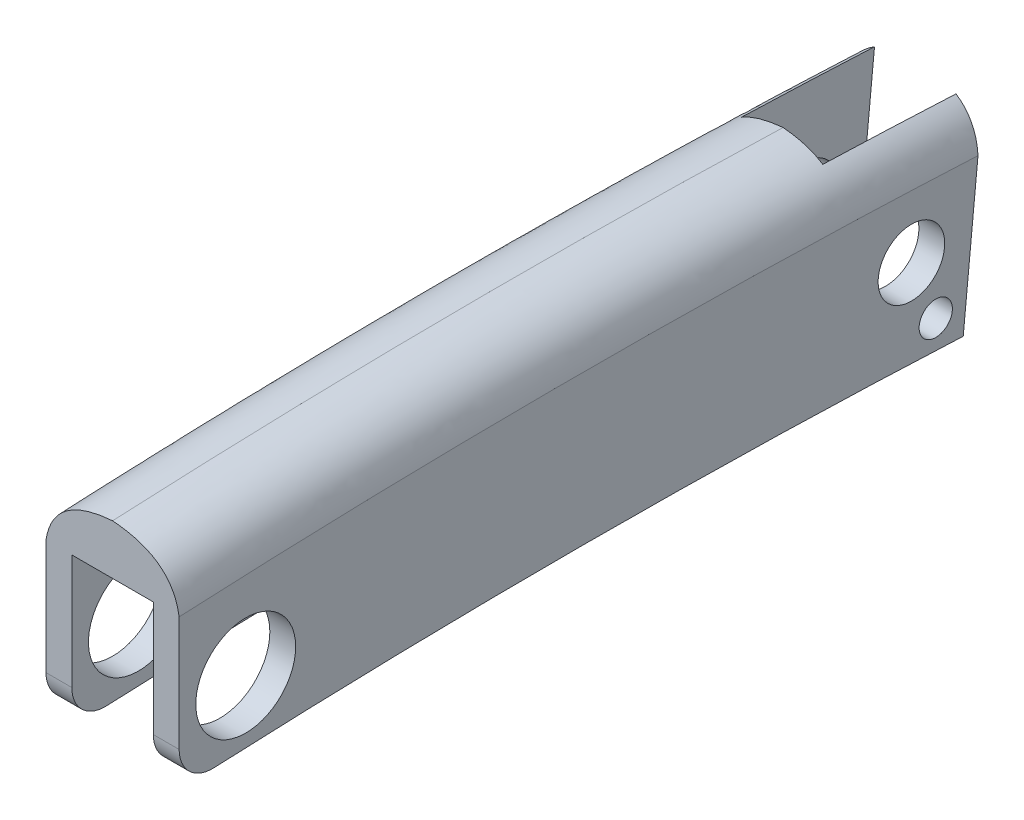
from build123d import *

# Parameters (mm, degrees)
SKETCH4_R          = 1.5
SKETCH4_R_2        = 1
CUT_EXTRUDE1_DEPTH = 23
FILLET1_R          = 1
SKETCH5_R          = 0.5
CUT_EXTRUDE2_DEPTH = 23
SKETCH6_W          = 2.449612404
SKETCH6_H          = 5.085440949
CUT_EXTRUDE3_DEPTH = 4


with BuildPart() as part:
    # Sweep1: sweep along a path in Sketch2
    with BuildLine() as sweep1_path:  # in the path sketch's own coordinates; laid on its plane below (add() does not lay a ready-made edge on the line's plane)
        add(Edge.make_bspline(
            [(0, 0), (12.002417385, 0.593156544), (24, 0)],
            knots=[0, 0, 0, 1, 1, 1], degree=2))
    # Sketch1 → Sweep1 (sweep)
    with BuildSketch(Plane.XY):
        with BuildLine():
            Line((-1.224806202, 0), (1.224806202, 0))
            Line((1.224806202, 0), (1.224806202, -4.5))
            Line((1.224806202, -4.5), (2, -4.5))
            Line((2, -4.5), (2, 0))
            add(Edge.make_bspline(
                [(2, 0), (1.789237919, 1.363268396), (0, 1.5)],
                knots=[0, 0, 0, 1, 1, 1], degree=2))
            add(Edge.make_bspline(
                [(-2, 0), (-1.789237919, 1.363268396), (0, 1.5)],
                knots=[0, 0, 0, 1, 1, 1], degree=2))
            Line((-2, 0), (-2, -4.5))
            Line((-2, -4.5), (-1.224806202, -4.5))
            Line((-1.224806202, -4.5), (-1.224806202, 0))
        make_face()
    sweep(path=Plane(origin=(0, 0, 0), x_dir=(0, 0, -1), z_dir=(1, 0, 0)) * sweep1_path.line)

    # Sketch4 → Cut-Extrude1 (cut)
    with BuildSketch(Plane(origin=(2, 0, 0), x_dir=(0, 0, -1), z_dir=(1, 0, 0))):
        with Locations((2, -2.524194964)):
            Circle(SKETCH4_R)
        with Locations((22, -1.784311687)):
            Circle(SKETCH4_R_2)
    extrude(amount=-CUT_EXTRUDE1_DEPTH, mode=Mode.SUBTRACT)

    # Fillet1
    fillet1_edges = [part.edges().sort_by_distance(p)[0] for p in [
        (-1.612403101, -4.5, 0),
        (1.612403101, -4.5, 0),
    ]]
    fillet(fillet1_edges, radius=FILLET1_R)

    # Sketch5 → Cut-Extrude2 (cut)
    with BuildSketch(Plane(origin=(2, 0, 0), x_dir=(0, 0, -1), z_dir=(1, 0, 0))):
        with Locations((22.73074773, -3.597243091)):
            Circle(SKETCH5_R)
    extrude(amount=-CUT_EXTRUDE2_DEPTH, mode=Mode.SUBTRACT)

    # Sketch6 → Cut-Extrude3 (cut)
    with BuildSketch(Plane(origin=(0, -2.35530576, -23.766585519), x_dir=(-1, 0, 0), z_dir=(0, -0.09861847381015884, -0.9951253170447204))):
        with Locations((0, 3.230896736)):
            Rectangle(SKETCH6_W, SKETCH6_H)
    extrude(amount=-CUT_EXTRUDE3_DEPTH, mode=Mode.SUBTRACT)


solid = part.part
